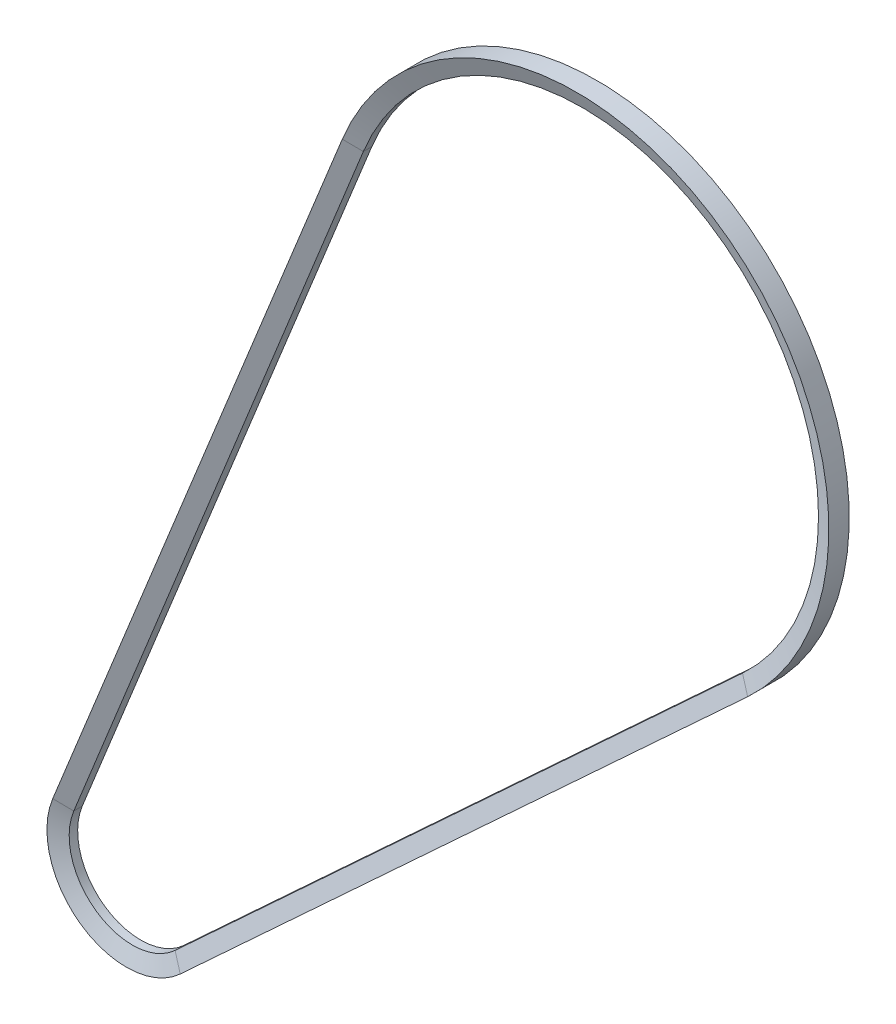
from build123d import *


with BuildPart() as part:
    # Sweep1: sweep along a path in Sketch2
    with BuildLine(Plane.XY) as sweep1_path:
        Line((-27.811189769, 11.248898774), (114.390439191, 362.820778649))
        ThreePointArc((114.390439191, 362.820778649), (286.392969207, 414.297883579), (299.005945866, 235.201050878))
        Line((299.005945866, 235.201050878), (20.349377189, -22.043204123))
        ThreePointArc((20.349377189, -22.043204123), (-17.059035453, -24.677708756), (-27.811189769, 11.248898774))
    # Sketch3 → Sweep1 (sweep)
    with BuildSketch(Plane(origin=(-27.811189769, 11.248898774, 0), x_dir=(0.927039658969431, -0.37496329246719756, 0), z_dir=(0.37496329246719756, 0.927039658969431, 0))):
        Polygon((-1, -2.088238126), (-1, 2.088238126), (-9, 5), (-9, -5), align=None)
    sweep(path=sweep1_path.line)


solid = part.part
